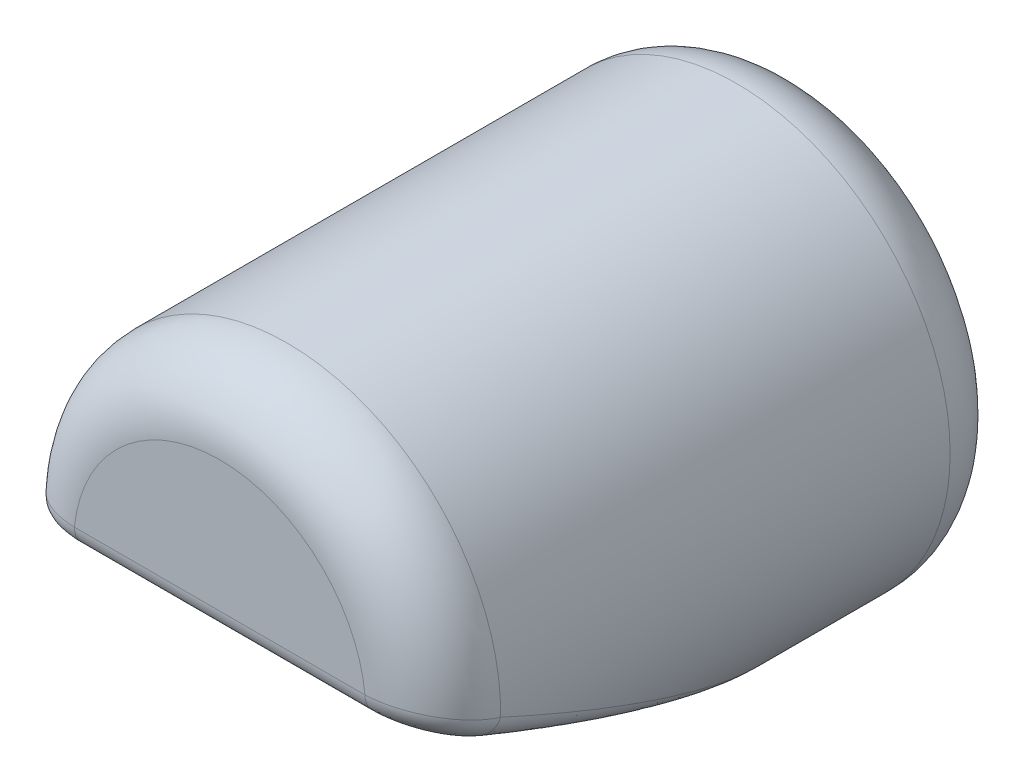
from build123d import *
from build123d.topology import SkipClean

# Parameters (mm, degrees)
SKETCH2_R               = 9.5
BOSS_EXTRUDE1_DEPTH     = 26
FILLET1_R               = 3
CUT_EXTRUDE1_DEPTH      = 10
CUT_EXTRUDE1_DEPTH_BACK = 10
FILLET2_R               = 1


with BuildPart() as part:
    # Sketch2 → Boss-Extrude1 (new body)
    with BuildSketch(Plane.XY):
        Circle(SKETCH2_R)
    extrude(amount=BOSS_EXTRUDE1_DEPTH)

    # Fillet1
    fillet1_edges = [part.edges().sort_by_distance(p)[0] for p in [
        (-9.5, 0, 26),
        (-9.5, 0, 0),
    ]]
    fillet(fillet1_edges, radius=FILLET1_R)

    # Sketch3 → Cut-Extrude1 (cut, two sides: drawn at the far end of the back side and taken through both)
    with SkipClean():  # the faces are left unmerged after this step: merging them gives an invalid solid
        with BuildSketch(Plane(origin=(0, 0, 0), x_dir=(0, 0, -1), z_dir=(1, 0, 0)).offset(-CUT_EXTRUDE1_DEPTH_BACK)):
            Polygon((-26, 0), (-3, -9.5), (-3, -10.4048104), (-26, -10.4048104), align=None)
        extrude(amount=CUT_EXTRUDE1_DEPTH + CUT_EXTRUDE1_DEPTH_BACK, mode=Mode.SUBTRACT)

    # Fillet2
    fillet2_edges = [part.edges().sort_by_distance(p)[0] for p in [
        (7.397028658, -5.961037413, 11.568014685),
        (8.650304994, -0.378600602, 25.083388017),
        (-7.397028654, -5.961037417, 11.568014675),
        (-8.65030496, -0.378600587, 25.083388053),
        (0, 0, 26),
    ]]
    fillet(fillet2_edges, radius=FILLET2_R)


solid = part.part
